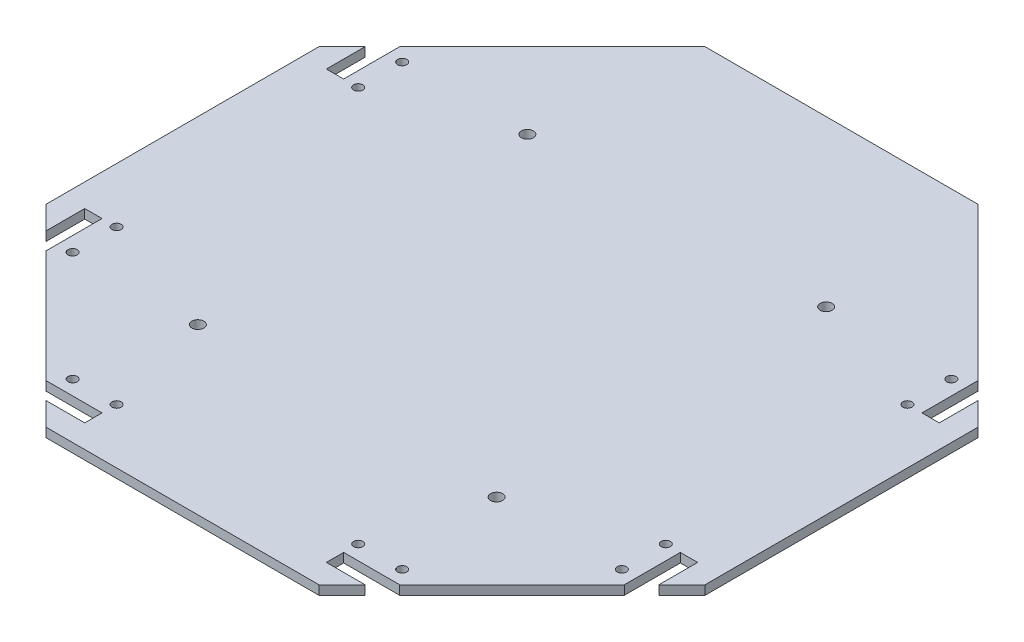
from build123d import *

# Parameters (mm, degrees)
SKETCH1_R            = 2.0828
BOSS_EXTRUDE1_DEPTH  = 3.175
M3_CLEARANCE_HOLE1_D = 3.2


with BuildPart() as part:
    # Sketch1 → Boss-Extrude1 (new body)
    with BuildSketch(Plane(origin=(0, 0, 0), x_dir=(1, 0, 0), z_dir=(0, 1, 0))):
        Polygon((28.855389821, 184.15), (123.544610179, 184.15), (176.5, 131.194610179), (176.5, 111.76), (182.5, 111.76), (182.5, 125.194610179), (190.5, 117.194610179), (190.5, 22.505389821), (182.5, 14.505389821), (182.5, 27.94), (176.5, 27.94), (176.5, 8.505389821), (137.544610179, -30.45), (118.11, -30.45), (118.11, -36.45), (131.544610179, -36.45), (123.544610179, -44.45), (28.855389821, -44.45), (20.855389821, -36.45), (34.29, -36.45), (34.29, -30.45), (14.855389821, -30.45), (-24.1, 8.505389821), (-24.1, 27.94), (-30.1, 27.94), (-30.1, 14.505389821), (-38.1, 22.505389821), (-38.1, 117.194610179), (-30.1, 125.194610179), (-30.1, 111.76), (-24.1, 111.76), (-24.1, 131.194610179), align=None)
        with Locations(Location((24.384, 12.7, 0), (0, 0, 270))):
            Circle(SKETCH1_R, mode=Mode.SUBTRACT)
        with Locations(Location((128.016, 12.7, 0), (0, 0, 90))):
            Circle(SKETCH1_R, mode=Mode.SUBTRACT)
        with Locations(Location((128.016, 127, 0), (0, 0, 270))):
            Circle(SKETCH1_R, mode=Mode.SUBTRACT)
        with Locations(Location((24.384, 127, 0), (0, 0, 90))):
            Circle(SKETCH1_R, mode=Mode.SUBTRACT)
    extrude(amount=BOSS_EXTRUDE1_DEPTH)

    # M3 Clearance Hole1 (through all)
    with Locations(Plane(origin=(0, 3.175, 0), x_dir=(1, 0, 0), z_dir=(0, 1, 0))):
        with Locations((-19.05, 127), (-19.05, 111.76), (-19.05, 27.94), (-19.05, 12.7), (171.45, 127), (171.45, 111.76), (171.45, 27.94), (171.45, 12.7), (133.35, -25.4), (118.11, -25.4), (34.29, -25.4), (19.05, -25.4)):
            Hole(M3_CLEARANCE_HOLE1_D / 2)


solid = part.part
